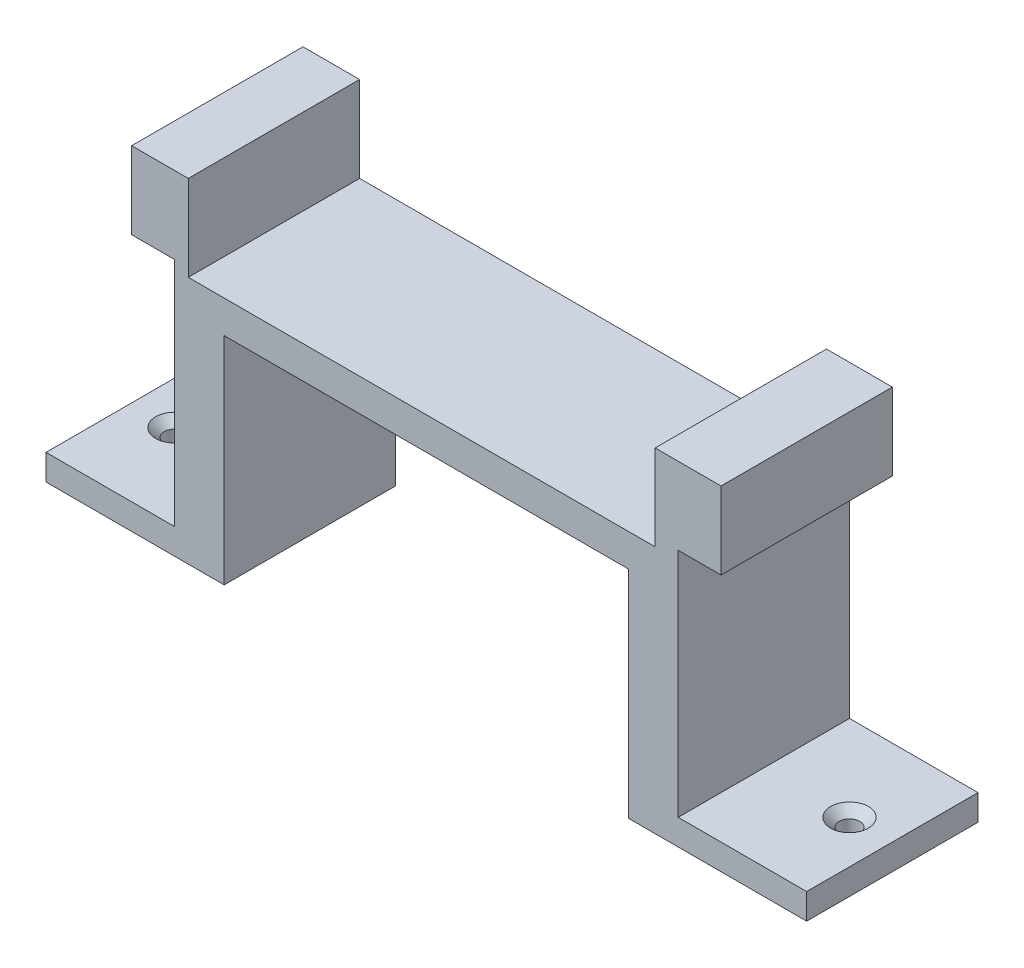
from build123d import *

# Parameters (mm, degrees)
SKETCH1_W                                       = 68.8
SKETCH1_H                                       = 39
BOSS_EXTRUDE1_DEPTH                             = 20
SKETCH2_W                                       = 47.2
SKETCH2_H                                       = 25.2
SKETCH2_W_2                                     = 54.5
SKETCH2_H_2                                     = 10
CUT_EXTRUDE1_DEPTH                              = 50
SKETCH3_W                                       = 5
SKETCH3_H                                       = 30
CUT_EXTRUDE2_DEPTH                              = 50
SKETCH4_W                                       = 20
SKETCH4_H                                       = 3
BOSS_EXTRUDE2_DEPTH                             = 15
SKETCH5_W                                       = 20
SKETCH5_H                                       = 3
BOSS_EXTRUDE3_DEPTH                             = 15
CSK_FOR_M2_FLAT_HEAD_MACHINE_SCREW1_D           = 2.4
CSK_FOR_M2_FLAT_HEAD_MACHINE_SCREW1_CSINK_D     = 4.4
CSK_FOR_M2_FLAT_HEAD_MACHINE_SCREW1_CSINK_ANGLE = 90
CSK_FOR_M2_FLAT_HEAD_MACHINE_SCREW2_D           = 2.4
CSK_FOR_M2_FLAT_HEAD_MACHINE_SCREW2_CSINK_D     = 4.4
CSK_FOR_M2_FLAT_HEAD_MACHINE_SCREW2_CSINK_ANGLE = 90


with BuildPart() as part:
    # Sketch1 → Boss-Extrude1 (new body)
    with BuildSketch(Plane.XY):
        Rectangle(SKETCH1_W, SKETCH1_H)
    extrude(amount=BOSS_EXTRUDE1_DEPTH)

    # Sketch2 → Cut-Extrude1 (cut)
    with BuildSketch(Plane.XY.offset(20)):
        with Locations((0, -6.9)):
            Rectangle(SKETCH2_W, SKETCH2_H)
        with Locations((-0.54, 14.5)):
            Rectangle(SKETCH2_W_2, SKETCH2_H_2)
    extrude(amount=-CUT_EXTRUDE1_DEPTH, mode=Mode.SUBTRACT)

    # Sketch3 → Cut-Extrude2 (cut)
    with BuildSketch(Plane.XY.offset(20)):
        with Locations((-31.9, -4.5)):
            Rectangle(SKETCH3_W, SKETCH3_H)
        with Locations((31.9, -4.5)):
            Rectangle(SKETCH3_W, SKETCH3_H)
    extrude(amount=-CUT_EXTRUDE2_DEPTH, mode=Mode.SUBTRACT)

    # Sketch4 → Boss-Extrude2 (add)
    with BuildSketch(Plane.ZY.offset(29.4)):
        with Locations((10, -18)):
            Rectangle(SKETCH4_W, SKETCH4_H)
    extrude(amount=BOSS_EXTRUDE2_DEPTH)

    # Sketch5 → Boss-Extrude3 (add)
    with BuildSketch(Plane(origin=(29.4, 0, 0), x_dir=(0, 0, -1), z_dir=(1, 0, 0))):
        with Locations((-10, -18)):
            Rectangle(SKETCH5_W, SKETCH5_H)
    extrude(amount=BOSS_EXTRUDE3_DEPTH)

    # CSK for M2 Flat Head Machine Screw1 (through all)
    with Locations(Plane(origin=(0, -16.5, 0), x_dir=(1, 0, 0), z_dir=(0, 1, 0))):
        with Locations((-39.4, -10)):
            CounterSinkHole(CSK_FOR_M2_FLAT_HEAD_MACHINE_SCREW1_D / 2, CSK_FOR_M2_FLAT_HEAD_MACHINE_SCREW1_CSINK_D / 2, counter_sink_angle=CSK_FOR_M2_FLAT_HEAD_MACHINE_SCREW1_CSINK_ANGLE)

    # CSK for M2 Flat Head Machine Screw2 (through all)
    with Locations(Plane(origin=(0, -16.5, 0), x_dir=(1, 0, 0), z_dir=(0, 1, 0))):
        with Locations((39.4, -10)):
            CounterSinkHole(CSK_FOR_M2_FLAT_HEAD_MACHINE_SCREW2_D / 2, CSK_FOR_M2_FLAT_HEAD_MACHINE_SCREW2_CSINK_D / 2, counter_sink_angle=CSK_FOR_M2_FLAT_HEAD_MACHINE_SCREW2_CSINK_ANGLE)


solid = part.part
